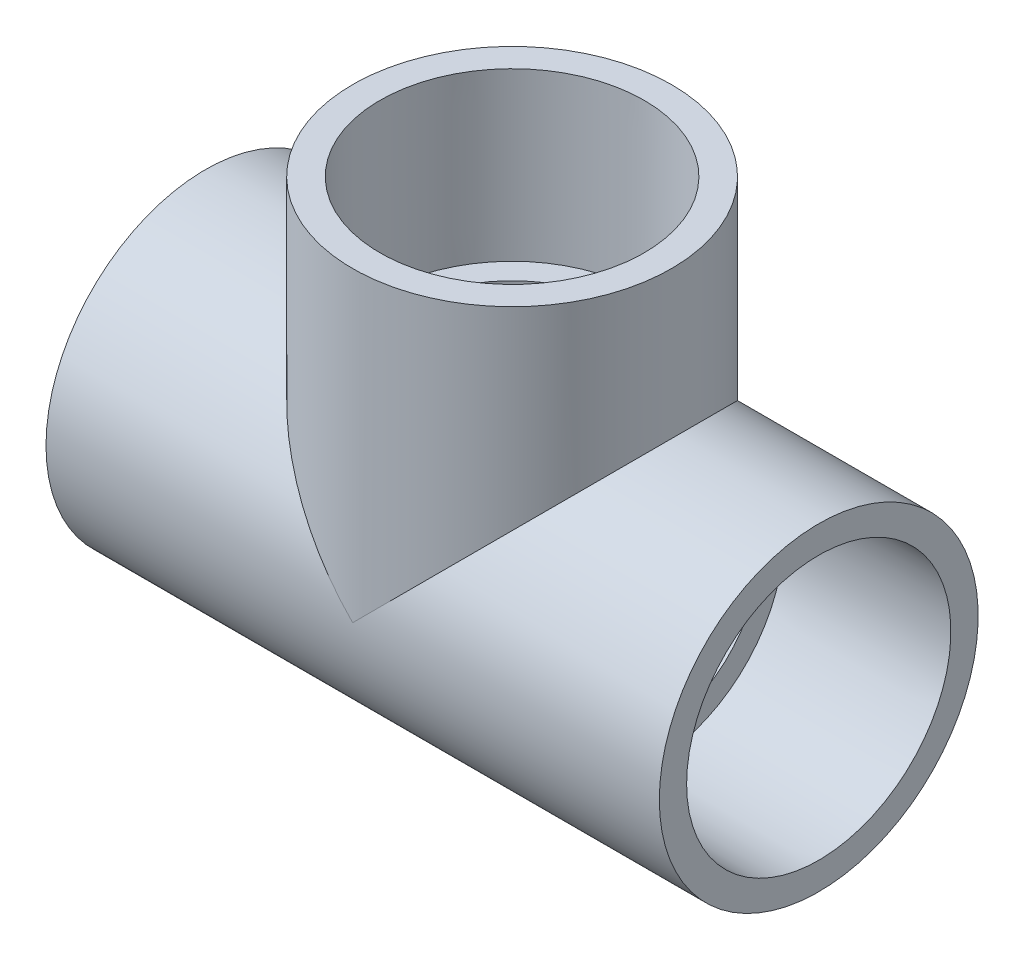
from build123d import *
from build123d.topology import SkipClean

# Parameters (mm, degrees)
BOSS_EXTRUDE1_START     = 64.516
BOSS_EXTRUDE1_DEPTH     = 64.516
BOSS_EXTRUDE2_REACH     = 107.006
SKETCH5_R               = 24.6253
CUT_EXTRUDE1_DEPTH      = 64.516
CUT_EXTRUDE2_REACH      = 107.006
CUT_EXTRUDE2_END_RADIUS = 24.6253
SKETCH6_R               = 24.6253


with BuildPart() as part:
    # Sketch1 → Revolve1 (revolve)
    with BuildSketch(Plane.XY, mode=Mode.PRIVATE) as revolve1_sk:
        Polygon((-70.358, -36.576), (-32.258, -36.576), (-32.258, -30.0863), (-70.358, -30.3149), align=None)
    revolve(revolve1_sk.sketch.rotate(Axis((-70.358, 0, 0), (1, 0, 0)), 270), axis=Axis((-70.358, 0, 0), (1, 0, 0)))


with BuildPart() as body_2:
    # Mirror1: mirrored copy
    add(part.part.mirror(Plane(origin=(0, 0, 0), x_dir=(0, 0, 1), z_dir=(1, 0, 0))))


with BuildPart() as body_3:
    # Sketch2 → Revolve2 (revolve)
    with BuildSketch(Plane.XY, mode=Mode.PRIVATE) as revolve2_sk:
        Polygon((30.3149, 70.358), (30.0863, 32.258), (36.576, 32.258), (36.576, 70.358), align=None)
    revolve(revolve2_sk.sketch.rotate(Axis((0, 0, 0), (0, 1, 0)), 90), axis=Axis((0, 0, 0), (0, 1, 0)))


with BuildPart() as part_1:
    with SkipClean():  # the faces are left unmerged after this step: merging them gives an invalid solid
        add(part.part)

        add(body_2.part)  # Boss-Extrude1 merges body 2

        add(body_3.part)  # Boss-Extrude1 merges body 3
        # Sketch3 → Boss-Extrude1 (add)
        with BuildSketch(Plane(origin=(-32.258, 0, 0), x_dir=(0, 0, -1), z_dir=(1, 0, 0)).offset(BOSS_EXTRUDE1_START)):
            with BuildLine():
                Line((17.240221, 32.258), (-17.240221, 32.258))
                ThreePointArc((-17.240221, 32.258), (0, -36.576), (17.240221, 32.258))
            make_face()
        extrude(amount=-BOSS_EXTRUDE1_DEPTH)

    # Sketch4 → Boss-Extrude2 (add, up to next)
    with BuildSketch(Plane.XZ.offset(-32.258), mode=Mode.PRIVATE) as boss_extrude2_sk1:
        with BuildLine():
            Line((32.258, -17.240221), (32.258, 17.240221))
            ThreePointArc((32.258, 17.240221), (0, 36.576), (-32.258, 17.240221))
            Line((-32.258, 17.240221), (-32.258, -17.240221))
            ThreePointArc((-32.258, -17.240221), (0, -36.576), (32.258, -17.240221))
        make_face()
    boss_extrude2_tool1 = extrude(boss_extrude2_sk1.sketch, amount=BOSS_EXTRUDE2_REACH, mode=Mode.PRIVATE) - part_1.part
    add(boss_extrude2_tool1.solids().sort_by_distance((0, 32.258, 0))[0])
    add(boss_extrude2_tool1.solids().sort_by_distance((0, 32.258, 0))[1])

    # Sketch5 → Cut-Extrude1 (cut)
    with SkipClean():  # the faces are left unmerged after this step: merging them gives an invalid solid
        with BuildSketch(Plane.ZY.offset(32.258)):
            Circle(SKETCH5_R)
        extrude(amount=-CUT_EXTRUDE1_DEPTH, mode=Mode.SUBTRACT)

    # Cut-Extrude2: up to this cylinder (the profile starts outside it)
    with SkipClean():  # the faces are left unmerged after this step: merging them gives an invalid solid
        cut_extrude2_end = Plane(origin=(0, 0, 0), z_dir=(-1, 0, 0)) * Cylinder(CUT_EXTRUDE2_END_RADIUS, 264.2626, mode=Mode.PRIVATE)
        # Sketch6 → Cut-Extrude2 (cut, up to the surface)
        with BuildSketch(Plane(origin=(0, 32.258, 0), x_dir=(1, 0, 0), z_dir=(0, 1, 0)), mode=Mode.PRIVATE) as cut_extrude2_sk1:
            with Locations(Location((0, 0, 0), (0, 0, 270))):
                Circle(SKETCH6_R)
        cut_extrude2_tool1 = extrude(cut_extrude2_sk1.sketch, amount=-CUT_EXTRUDE2_REACH, mode=Mode.PRIVATE) - cut_extrude2_end
        add(cut_extrude2_tool1.solids().sort_by_distance((0, 32.258, 0))[0], mode=Mode.SUBTRACT)


solid = part_1.part
